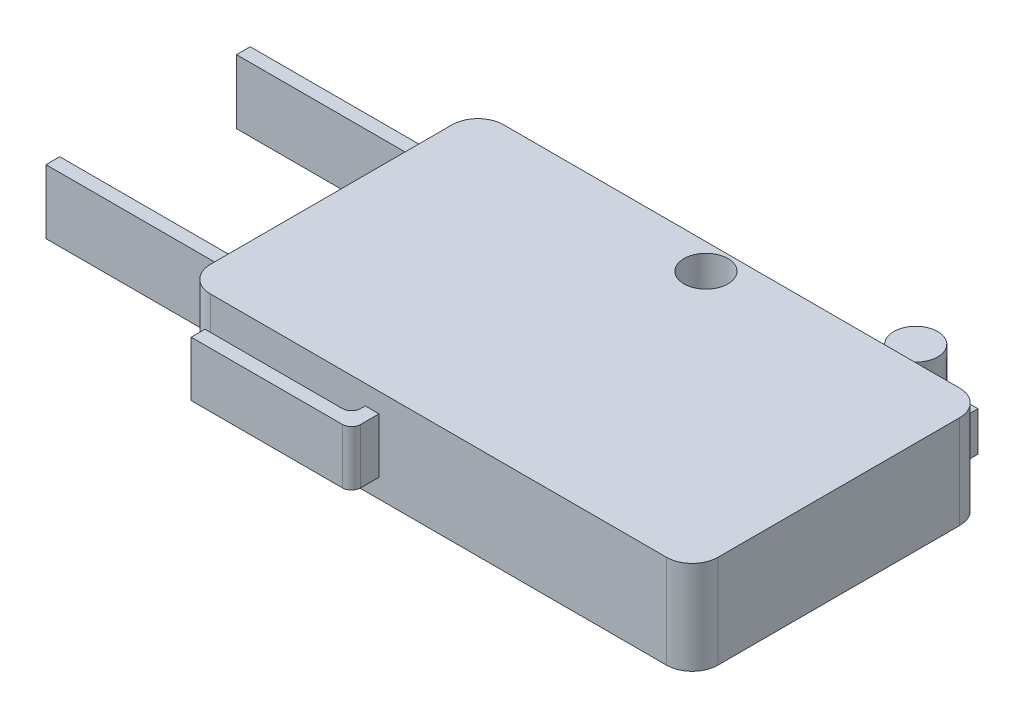
from build123d import *

# Parameters (mm, degrees)
BOSS_EXTRUDE2_DEPTH  = 10.2
SKETCH3_W            = 19.6
SKETCH3_H            = 4.3
BOSS_EXTRUDE3_DEPTH  = 2
FILLET3_R            = 1
SKETCH4_W            = 1.5
SKETCH4_H            = 7
BOSS_EXTRUDE4_DEPTH  = 20
SKETCH5_W            = 1.5
SKETCH5_H            = 7
BOSS_EXTRUDE5_DEPTH  = 20
SKETCH6_W            = 1.5
SKETCH6_H            = 6
BOSS_EXTRUDE7_DEPTH  = 3
SKETCH8_W            = 1.5
SKETCH8_H            = 6
BOSS_EXTRUDE8_DEPTH  = 16
FILLET4_R            = 1
FILLET5_R            = 1
BOSS_EXTRUDE10_DEPTH = 4
SKETCH12_R           = 2.4
CUT_EXTRUDE1_DEPTH   = 19


with BuildPart() as part:
    # Sketch1 → Boss-Extrude2 (new body)
    with BuildSketch(Plane(origin=(0, 0, 0), x_dir=(1, 0, 0), z_dir=(0, 1, 0))):
        with BuildLine():
            Line((-24.9, 16), (24.9, 16))
            ThreePointArc((24.9, 16), (26.879898987, 15.179898987), (27.7, 13.2))
            Line((27.7, 13.2), (27.7, -13.2))
            ThreePointArc((27.7, -13.2), (26.879898987, -15.179898987), (24.9, -16))
            Line((24.9, -16), (-24.9, -16))
            ThreePointArc((-24.9, -16), (-26.879898987, -15.179898987), (-27.7, -13.2))
            Line((-27.7, -13.2), (-27.7, 13.2))
            ThreePointArc((-27.7, 13.2), (-26.879898987, 15.179898987), (-24.9, 16))
        make_face()
    extrude(amount=BOSS_EXTRUDE2_DEPTH)

    # Sketch3 → Boss-Extrude3 (add)
    with BuildSketch(Plane(origin=(0, 0, -16), x_dir=(-1, 0, 0), z_dir=(0, 0, -1))):
        with Locations((-15.1, 5.1)):
            Rectangle(SKETCH3_W, SKETCH3_H)
    extrude(amount=BOSS_EXTRUDE3_DEPTH)

    # Fillet3
    fillet3_edges = [part.edges().sort_by_distance(p)[0] for p in [
        (5.3, 5.1, -18),
    ]]
    fillet(fillet3_edges, radius=FILLET3_R)

    # Sketch4 → Boss-Extrude4 (add)
    with BuildSketch(Plane.ZY.offset(27.7)):
        with Locations((-10.4, 5.1)):
            Rectangle(SKETCH4_W, SKETCH4_H)
    extrude(amount=BOSS_EXTRUDE4_DEPTH)

    # Sketch5 → Boss-Extrude5 (add)
    with BuildSketch(Plane.ZY.offset(27.7)):
        with Locations((10.4, 5.1)):
            Rectangle(SKETCH5_W, SKETCH5_H)
    extrude(amount=BOSS_EXTRUDE5_DEPTH)

    # Sketch6 → Boss-Extrude7 (add)
    with BuildSketch(Plane.XY.offset(16)):
        with Locations((-7.247043242, 5.066819201)):
            Rectangle(SKETCH6_W, SKETCH6_H)
    extrude(amount=BOSS_EXTRUDE7_DEPTH)

    # Sketch8 → Boss-Extrude8 (add)
    with BuildSketch(Plane.ZY.offset(7.997043242)):
        with Locations((18.25, 5.066819201)):
            Rectangle(SKETCH8_W, SKETCH8_H)
    extrude(amount=BOSS_EXTRUDE8_DEPTH)

    # Fillet4
    fillet4_edges = [part.edges().sort_by_distance(p)[0] for p in [
        (-7.997043242, 5.066819201, 17.5),
    ]]
    fillet(fillet4_edges, radius=FILLET4_R)

    # Fillet5
    fillet5_edges = [part.edges().sort_by_distance(p)[0] for p in [
        (-6.497043242, 5.066819201, 19),
    ]]
    fillet(fillet5_edges, radius=FILLET5_R)

    # Sketch11 → Boss-Extrude10 (add)
    with BuildSketch(Plane.XZ.offset(-2.95)):
        with BuildLine():
            Line((16.614530509, -19.138227367), (16.614530509, -16))
            Line((16.614530509, -16), (13.585469491, -16))
            Line((13.585469491, -16), (13.585469491, -19.138227367))
            ThreePointArc((13.585469491, -19.138227367), (15.1, -23.4), (16.614530509, -19.138227367))
        make_face()
    extrude(amount=-BOSS_EXTRUDE10_DEPTH)

    # Sketch12 → Cut-Extrude1 (cut)
    with BuildSketch(Plane(origin=(0, 10.2, 0), x_dir=(1, 0, 0), z_dir=(0, 1, 0))):
        with Locations(Location((0, 13.2, 0), (0, 0, 270))):
            Circle(SKETCH12_R)
    extrude(amount=-CUT_EXTRUDE1_DEPTH, mode=Mode.SUBTRACT)


solid = part.part
